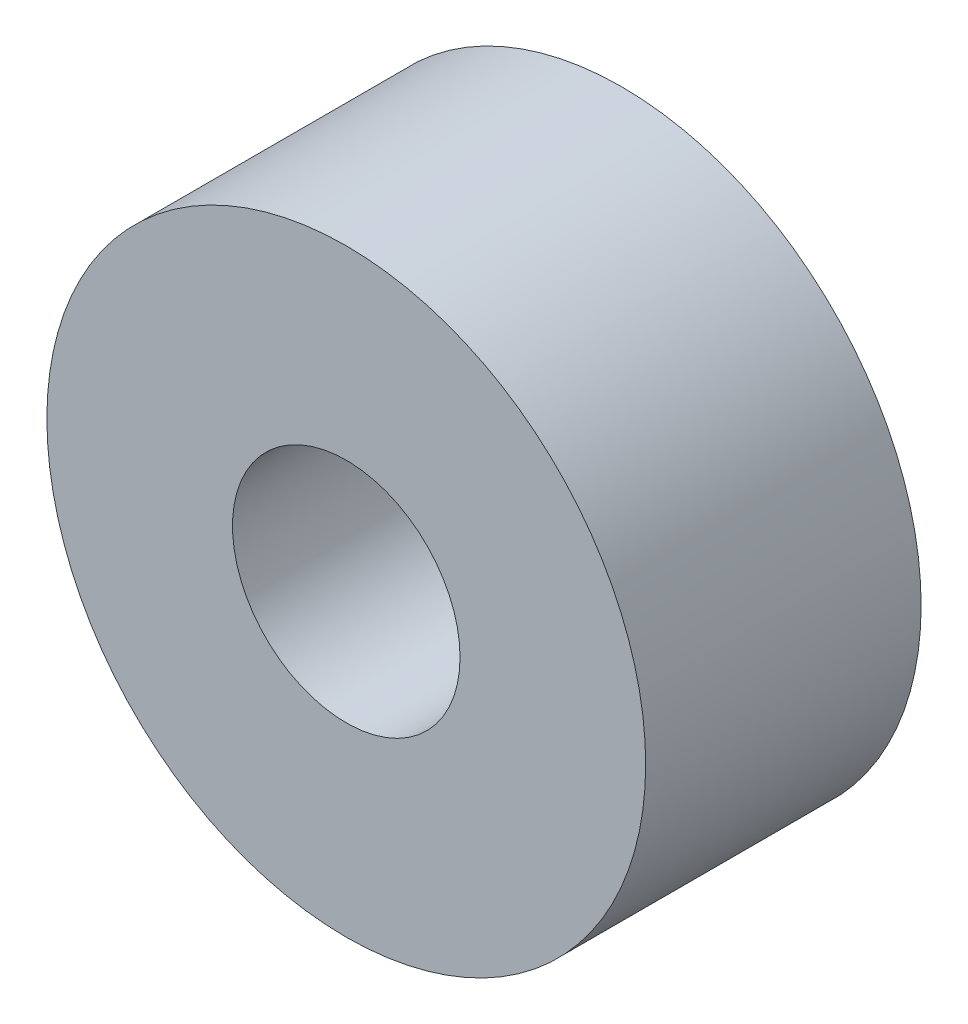
from build123d import *

# Parameters (mm, degrees)
SKETCH1_R           = 6.35
SKETCH1_R_2         = 2.413
BOSS_EXTRUDE1_DEPTH = 5.842


with BuildPart() as part:
    # Sketch1 → Boss-Extrude1 (new body)
    with BuildSketch(Plane.XY):
        Circle(SKETCH1_R)
        Circle(SKETCH1_R_2, mode=Mode.SUBTRACT)
    extrude(amount=BOSS_EXTRUDE1_DEPTH)


solid = part.part
